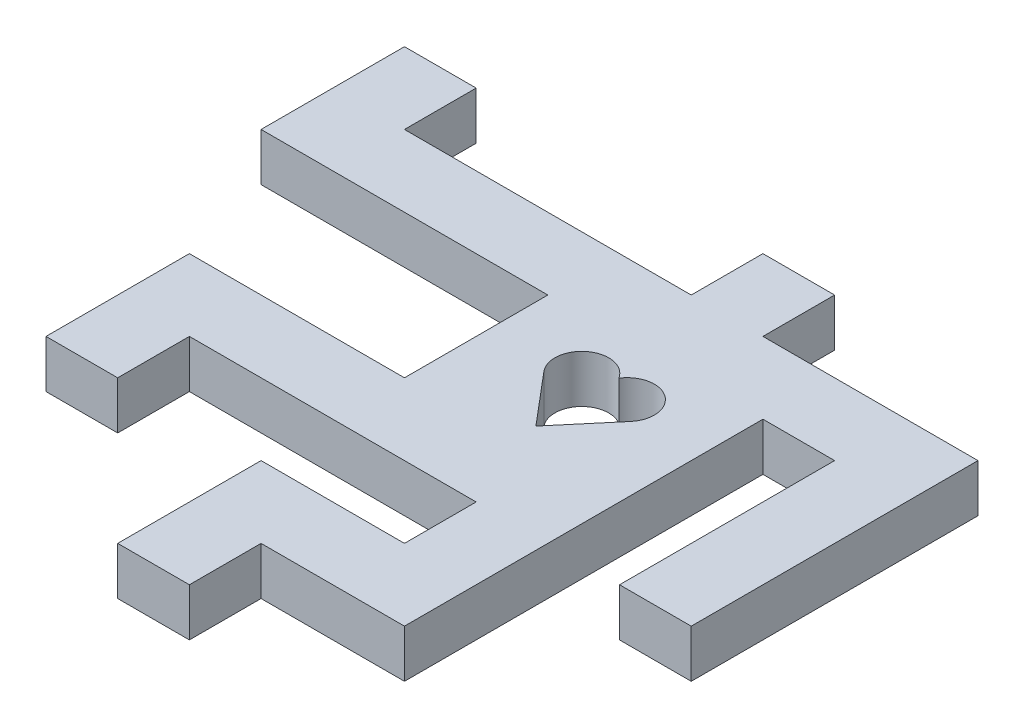
from build123d import *

# Parameters (mm, degrees)
SKETCH1_W           = 22.5
SKETCH1_H           = 30
SKETCH1_W_2         = 7.5
SKETCH1_H_2         = 7.5
BOSS_EXTRUDE1_DEPTH = 5
CUT_EXTRUDE3_DEPTH  = 10


with BuildPart() as part:
    # Sketch1 → Boss-Extrude1 (new body)
    with BuildSketch(Plane(origin=(0, 0, 0), x_dir=(1, 0, 0), z_dir=(0, 1, 0))):
        Polygon((-11.25, 7.5), (-11.25, 15), (-33.75, 15), (-33.75, 22.5), (-41.25, 22.5), (-41.25, 7.5), align=None)
        Polygon((-26.25, -15), (-11.25, -15), (-11.25, -7.5), (-33.75, -7.5), (-33.75, -22.5), (-26.25, -22.5), align=None)
        Rectangle(SKETCH1_W, SKETCH1_H)
        Polygon((11.25, -30), (11.25, -15), (3.75, -15), (3.75, -22.5), (-11.25, -22.5), (-11.25, -37.5), (-3.75, -37.5), (-3.75, -30), align=None)
        with Locations((0, 18.75)):
            Rectangle(SKETCH1_W_2, SKETCH1_H_2)
        Polygon((26.25, 15), (11.25, 15), (11.25, 7.5), (18.75, 7.5), (18.75, -15), (26.25, -15), align=None)
    extrude(amount=BOSS_EXTRUDE1_DEPTH)

    # Sketch2 → Cut-Extrude3 (cut)
    with BuildSketch(Plane(origin=(0, 5, 0), x_dir=(1, 0, 0), z_dir=(0, 1, 0))):
        with BuildLine():
            Line((0, -5), (4.534880693, 0.371878565))
            ThreePointArc((4.534880693, 0.371878565), (4.042699073, 4.459844977), (0, 3.678630324))
            ThreePointArc((0, 3.678630324), (-4.042699073, 4.459844977), (-4.534880693, 0.371878565))
            Line((-4.534880693, 0.371878565), (0, -5))
        make_face()
    extrude(amount=-CUT_EXTRUDE3_DEPTH, mode=Mode.SUBTRACT)


solid = part.part
